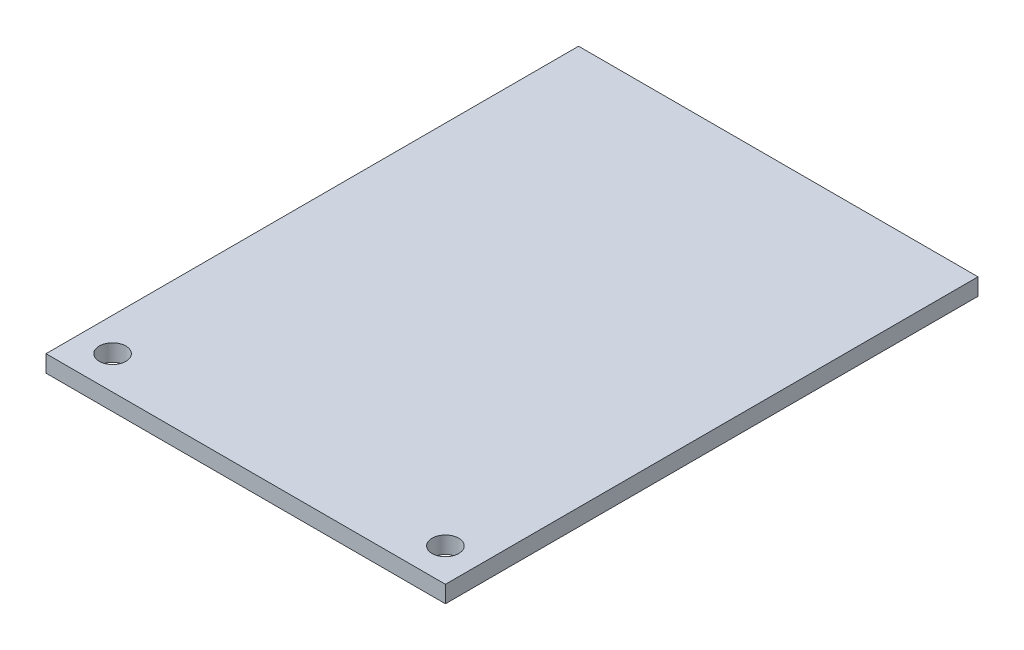
from build123d import *

# Parameters (mm, degrees)
SKETCH1_W           = 60
SKETCH1_H           = 80
BOSS_EXTRUDE1_DEPTH = 2.54
SKETCH3_R           = 2
CUT_EXTRUDE1_DEPTH  = 51.06447443


with BuildPart() as part:
    # Sketch1 → Boss-Extrude1 (new body)
    with BuildSketch(Plane(origin=(0, 0, 0), x_dir=(1, 0, 0), z_dir=(0, 1, 0))):
        Rectangle(SKETCH1_W, SKETCH1_H)
    extrude(amount=BOSS_EXTRUDE1_DEPTH)

    # Sketch3 → Cut-Extrude1 (cut, through all)
    with BuildSketch(Plane(origin=(0, 2.54, 0), x_dir=(1, 0, 0), z_dir=(0, 1, 0))):
        with Locations(Location((-25, -35, 0), (0, 0, 270))):
            Circle(SKETCH3_R)
    cut_extrude1 = extrude(amount=-CUT_EXTRUDE1_DEPTH, mode=Mode.SUBTRACT)

    # Mirror1: Cut-Extrude1 across plane
    add(cut_extrude1.mirror(Plane(origin=(0, 0, 0), x_dir=(0, 0, 1), z_dir=(1, 0, 0))), mode=Mode.SUBTRACT)


solid = part.part
